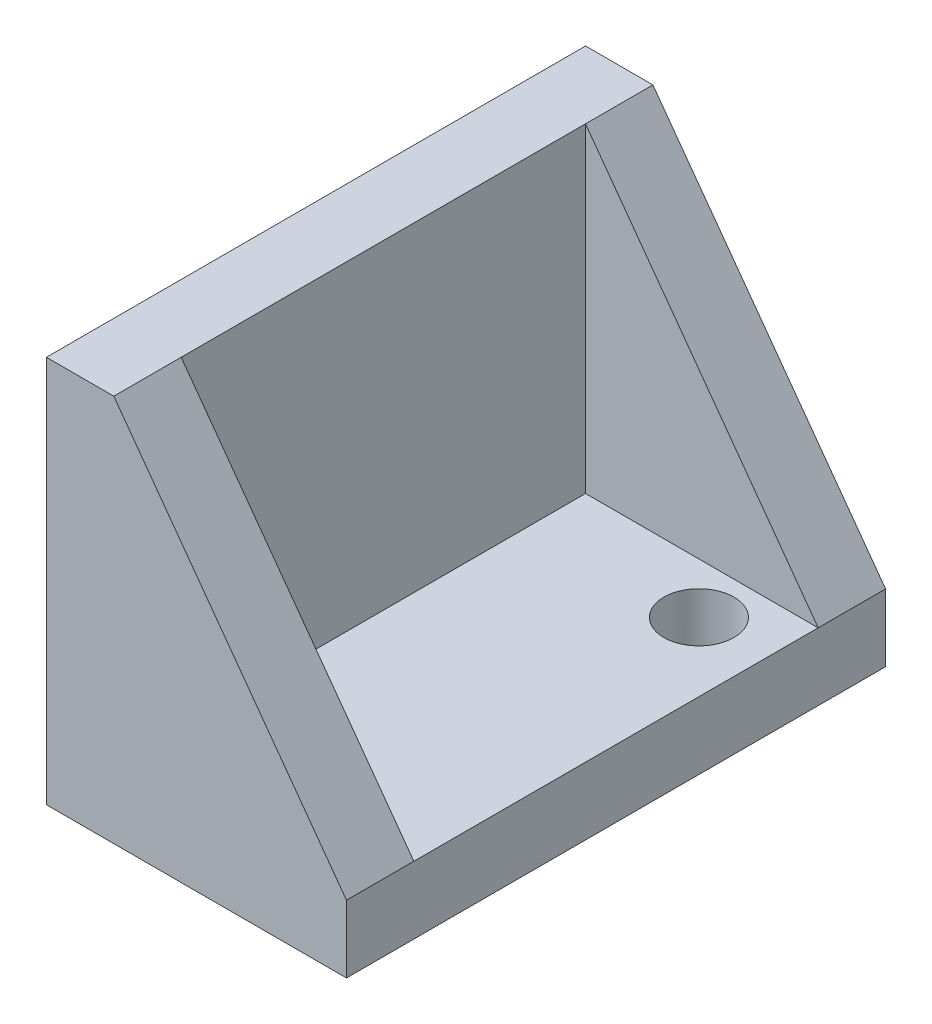
from build123d import *

# Parameters (mm, degrees)
BOSS_EXTRUDE1_START     = 1057.012834
BOSS_EXTRUDE1_DEPTH     = 50.8
CUT_EXTRUDE1_DEPTH      = 1125.4772971
CUT_EXTRUDE1_DEPTH_BACK = 1125.4772971
SKETCH2_R               = 3.302
BOSS_EXTRUDE2_START     = 1057.012834
BOSS_EXTRUDE2_DEPTH     = 6.35
BOSS_EXTRUDE3_START     = 1101.462834
BOSS_EXTRUDE3_DEPTH     = 6.35


with BuildPart() as part:
    # Sketch1 → Boss-Extrude1 (new body)
    with BuildSketch(Plane.XY.offset(BOSS_EXTRUDE1_START)):
        Polygon((152.527062484, 81.531574554), (152.527062484, 87.881574554), (130.604002291, 87.881574554), (130.604002291, 118.048344881), (124.254002291, 118.048344881), (124.254002291, 81.531574554), align=None)
    extrude(amount=BOSS_EXTRUDE1_DEPTH)

    # Sketch2 → Cut-Extrude1 (cut, two sides: drawn at the far end of the back side and taken through both)
    with BuildSketch(Plane(origin=(0, 0, 0), x_dir=(1, 0, 0), z_dir=(0, 1, 0)).offset(-CUT_EXTRUDE1_DEPTH_BACK)):
        with Locations(Location((146.050062484, -1068.125334154, 0), (0, 0, 90))):
            Circle(SKETCH2_R)
    extrude(amount=CUT_EXTRUDE1_DEPTH + CUT_EXTRUDE1_DEPTH_BACK, mode=Mode.SUBTRACT)

    # Sketch3 → Boss-Extrude2 (add)
    with BuildSketch(Plane.XY.offset(BOSS_EXTRUDE2_START)):
        Polygon((130.604002291, 118.048344881), (152.527062484, 87.881574554), (130.604002291, 87.881574554), align=None)
    extrude(amount=BOSS_EXTRUDE2_DEPTH)

    # Sketch3<2> → Boss-Extrude3 (add)
    with BuildSketch(Plane.XY.offset(BOSS_EXTRUDE3_START)):
        Polygon((130.604002291, 118.048344881), (152.527062484, 87.881574554), (130.604002291, 87.881574554), align=None)
    extrude(amount=BOSS_EXTRUDE3_DEPTH)


solid = part.part
